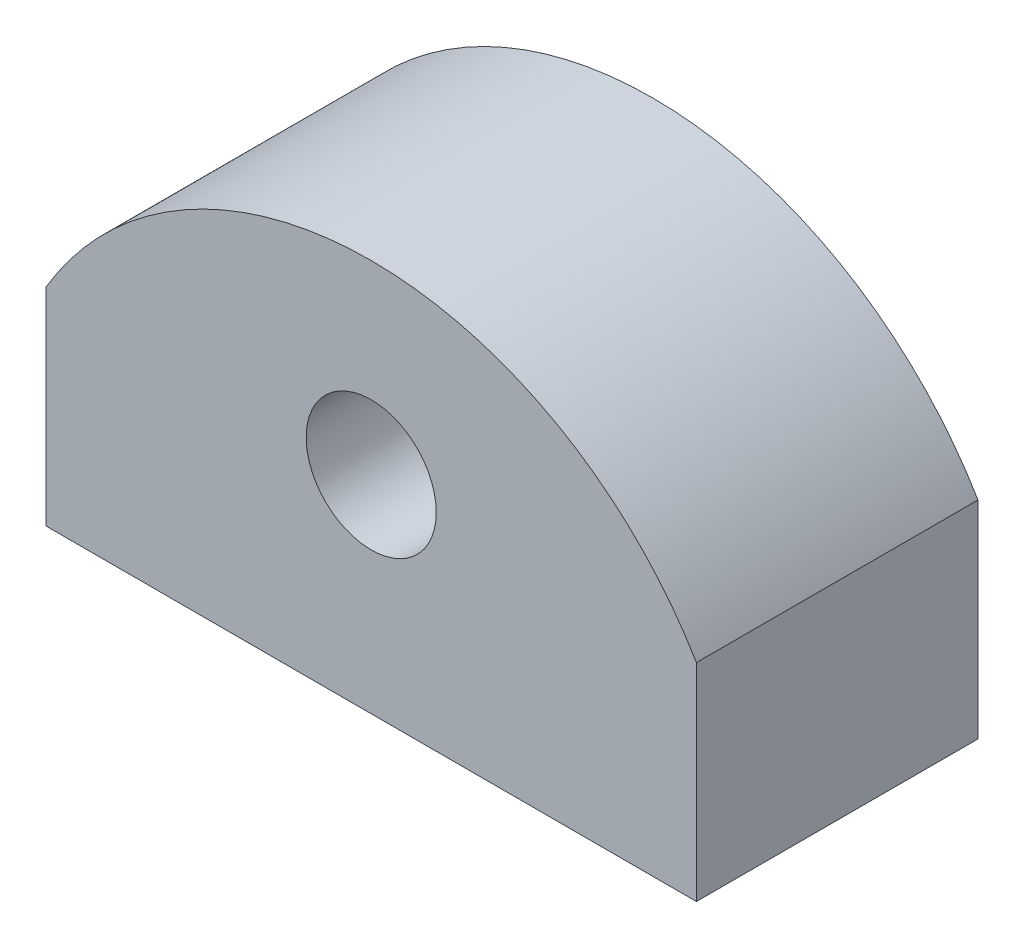
from build123d import *

# Parameters (mm, degrees)
BOSS_EXTRUDE1_DEPTH = 9.525
SKETCH2_R           = 2.2
M5_DRILL_DEPTH      = 9.525
SKETCH3_R           = 1.75
M4_DRILL_DEPTH      = 8


with BuildPart() as part:
    # Sketch1 → Boss-Extrude1 (new body)
    with BuildSketch(Plane.XY):
        with BuildLine():
            Line((-11, 3.5), (-11, -3.5))
            Line((-11, -3.5), (11, -3.5))
            Line((11, -3.5), (11, 3.5))
            ThreePointArc((11, 3.5), (0, 9.776932339), (-11, 3.5))
        make_face()
    extrude(amount=BOSS_EXTRUDE1_DEPTH)

    # Sketch2 → M5_DRILL (cut)
    with BuildSketch(Plane.XY.offset(9.525)):
        with Locations((0, 3.5)):
            Circle(SKETCH2_R)
    extrude(amount=-M5_DRILL_DEPTH, mode=Mode.SUBTRACT)

    # Sketch3 → M4_DRILL (cut)
    with BuildSketch(Plane.XZ.offset(3.5)):
        with Locations(Location((-6, 4.7625, 0), (0, 0, 270))):
            Circle(SKETCH3_R)
        with Locations(Location((6, 4.7625, 0), (0, 0, 90))):
            Circle(SKETCH3_R)
    extrude(amount=-M4_DRILL_DEPTH, mode=Mode.SUBTRACT)


solid = part.part
